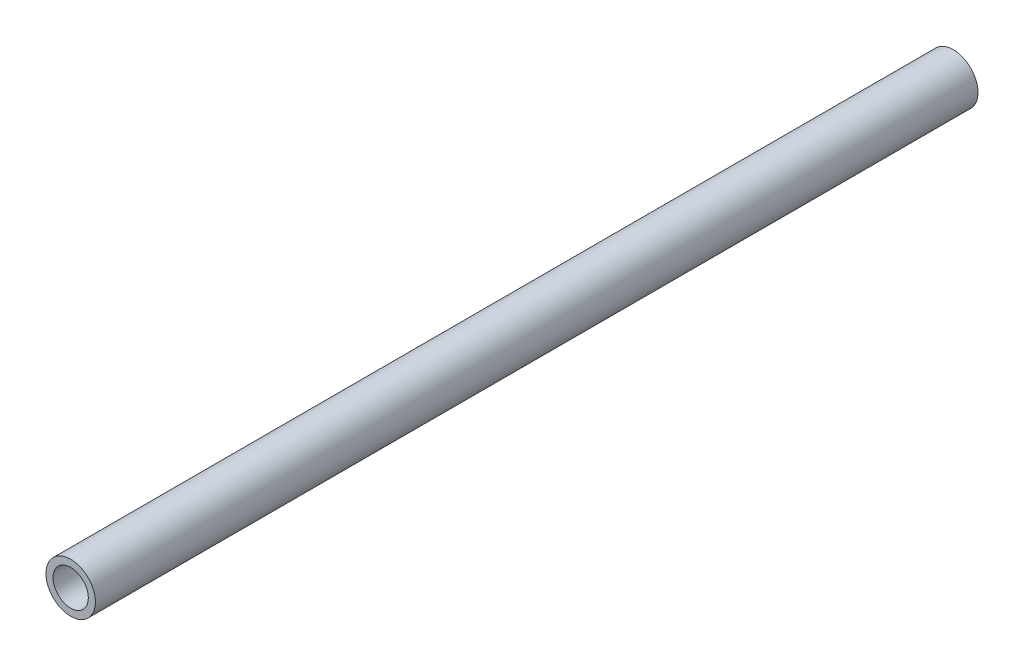
from build123d import *

# Parameters (mm, degrees)
SZKIC1_R                    = 7
SZKIC1_R_2                  = 5
DODANIE_WYCI_GNI_CIE1_DEPTH = 250


with BuildPart() as part:
    # Szkic1 → Dodanie-wyciągnięcie1 (new body)
    with BuildSketch(Plane.XY):
        Circle(SZKIC1_R)
        Circle(SZKIC1_R_2, mode=Mode.SUBTRACT)
    extrude(amount=DODANIE_WYCI_GNI_CIE1_DEPTH)


solid = part.part
